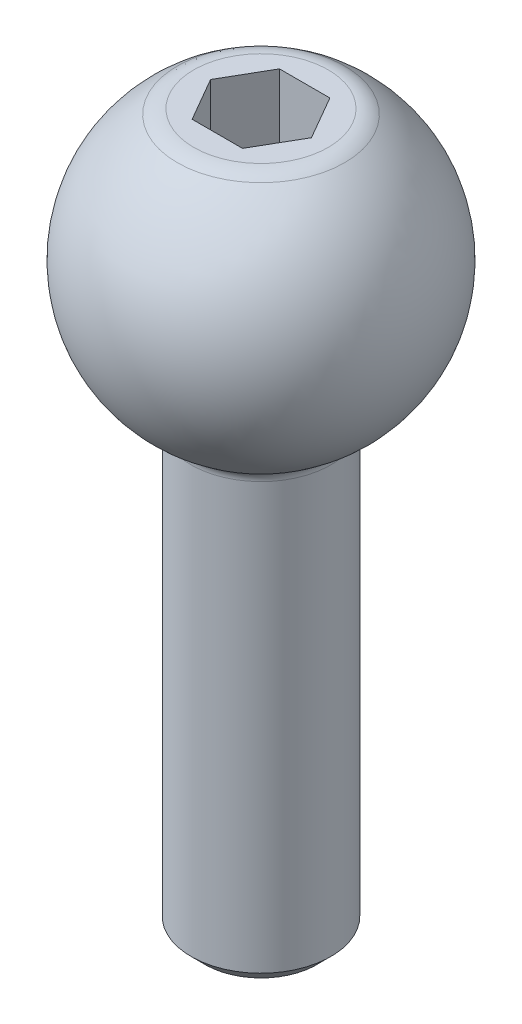
from build123d import *

# Parameters (mm, degrees)
FILLET1_R          = 0.381
CHAMFER1_SIZE      = 0.381
FILLET2_R          = 0.8128
CUT_EXTRUDE1_DEPTH = 2.54


with BuildPart() as part:
    # Sketch1 → Revolve1 (revolve)
    with BuildSketch(Plane.XY, mode=Mode.PRIVATE) as revolve1_sk:
        with BuildLine():
            Line((0, -15.875), (-1.905, -15.875))
            Line((-1.905, -15.875), (-1.905, -3.661588624))
            ThreePointArc((-1.905, -3.661588624), (-4.009330573, 0.980573609), (0, 4.1275))
            Line((0, 4.1275), (0, -15.875))
        make_face()
    revolve(revolve1_sk.sketch.rotate(Axis((0, -648.634401367, 0), (0, 1, 0)), 180), axis=Axis((0, -648.634401367, 0), (0, 1, 0)))

    # Fillet1
    fillet1_edges = [part.edges().sort_by_distance(p)[0] for p in [
        (-1.905, -3.661588624, 0),
    ]]
    fillet(fillet1_edges, radius=FILLET1_R)

    # Chamfer1
    chamfer1_edges = [part.edges().sort_by_distance(p)[0] for p in [
        (-1.905, -15.875, 0),
    ]]
    chamfer(chamfer1_edges, length=CHAMFER1_SIZE)

    # Split1
    split(bisect_by=Plane.ZX.offset(3.574519854), keep=Keep.BOTTOM)

    # Fillet2
    fillet2_edges = [part.edges().sort_by_distance(p)[0] for p in [
        (-2.06375, 3.574519854, 0),
    ]]
    fillet(fillet2_edges, radius=FILLET2_R)

    # Sketch3 → Cut-Extrude1 (cut)
    with BuildSketch(Plane(origin=(0, 3.574519854, 0), x_dir=(1, 0, 0), z_dir=(0, 1, 0))):
        Polygon((0.687407664, 1.190625), (-0.687407664, 1.190625), (-1.374815329, 0), (-0.687407664, -1.190625), (0.687407664, -1.190625), (1.374815329, 0), align=None)
    extrude(amount=-CUT_EXTRUDE1_DEPTH, mode=Mode.SUBTRACT)


solid = part.part
